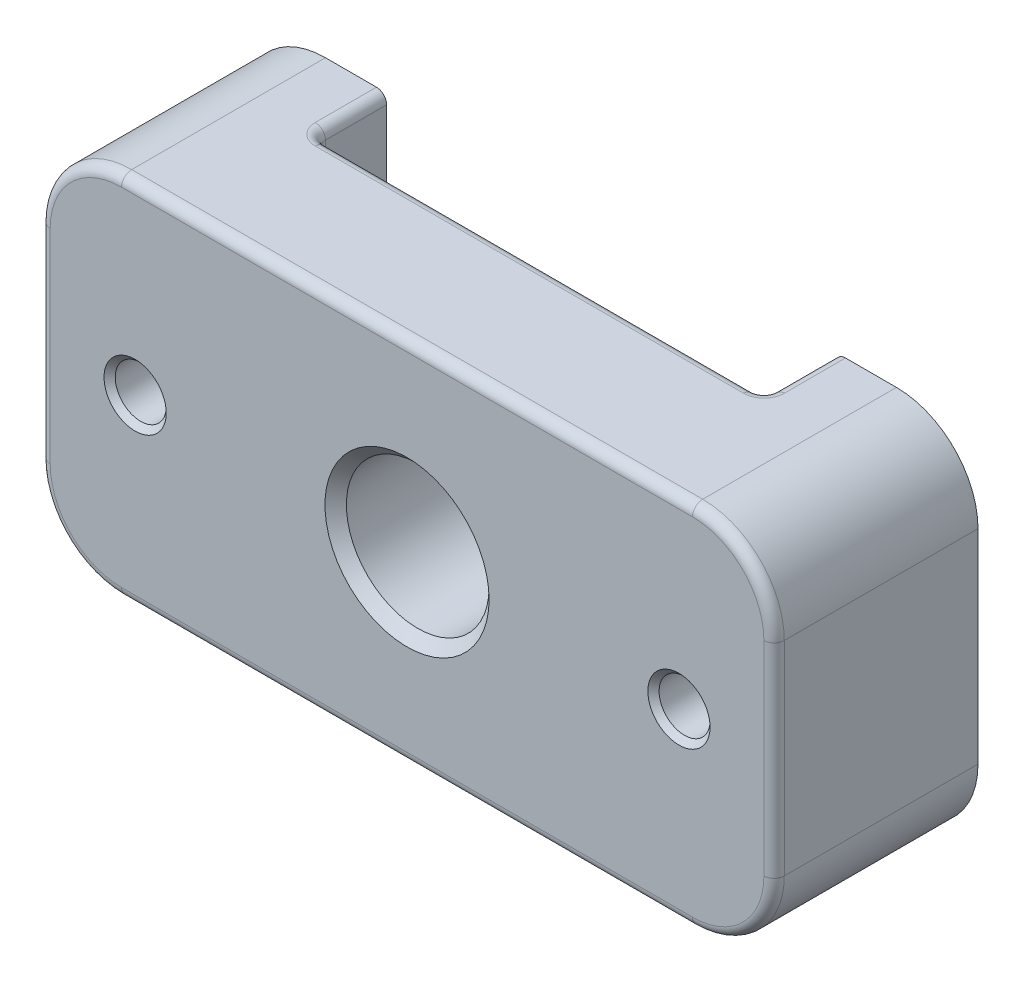
from build123d import *

# Parameters (mm, degrees)
BOSS_EXTRUDE1_DEPTH             = 10
SKETCH5_W                       = 22
SKETCH5_H                       = 7
CUT_EXTRUDE2_DEPTH              = 28.349588662
FILLET3_R                       = 0.5
M3X0_5_TAPPED_HOLE1_D           = 2.5
M3X0_5_TAPPED_HOLE1_CSINK_D     = 3.05
M3X0_5_TAPPED_HOLE1_CSINK_ANGLE = 90
M8X1_0_TAPPED_HOLE1_D           = 7
M8X1_0_TAPPED_HOLE1_CSINK_D     = 8.05
M8X1_0_TAPPED_HOLE1_CSINK_ANGLE = 90


with BuildPart() as part:
    # Sketch1 → Boss-Extrude1 (new body)
    with BuildSketch(Plane.XY):
        with BuildLine():
            Line((-14, 9.141740125), (14, 9.141740125))
            ThreePointArc((14, 9.141740125), (16.828427125, 7.97016725), (18, 5.141740125))
            Line((18, 5.141740125), (18, -4.858259875))
            ThreePointArc((18, -4.858259875), (16.828427125, -7.686686999), (14, -8.858259875))
            Line((14, -8.858259875), (-14, -8.858259875))
            ThreePointArc((-14, -8.858259875), (-16.828427125, -7.686686999), (-18, -4.858259875))
            Line((-18, -4.858259875), (-18, 5.141740125))
            ThreePointArc((-18, 5.141740125), (-16.828427125, 7.97016725), (-14, 9.141740125))
        make_face()
    extrude(amount=BOSS_EXTRUDE1_DEPTH)

    # Sketch5 → Cut-Extrude2 (cut, through all)
    with BuildSketch(Plane(origin=(0, 9.141740125, 0), x_dir=(1, 0, 0), z_dir=(0, 1, 0))):
        Rectangle(SKETCH5_W, SKETCH5_H)
    extrude(amount=-CUT_EXTRUDE2_DEPTH, mode=Mode.SUBTRACT)

    # Fillet3
    fillet3_edges = [part.edges().sort_by_distance(p)[0] for p in [
        (-16.828427125, 7.97016725, 10),
        (-18, 0.141740125, 10),
        (-16.828427125, -7.686686999, 10),
        (0, -8.858259875, 10),
        (16.828427125, -7.686686999, 10),
        (11, -8.858259875, 1.75),
        (18, 0.141740125, 10),
        (0, -8.858259875, 3.5),
        (11, 0.141740125, 3.5),
        (-11, -8.858259875, 1.75),
        (-11, 0.141740125, 3.5),
        (-11, 9.141740125, 1.75),
        (0, 9.141740125, 3.5),
        (11, 9.141740125, 1.75),
        (16.828427125, 7.97016725, 10),
        (0, 9.141740125, 10),
    ]]
    fillet(fillet3_edges, radius=FILLET3_R)

    # M3x0.5 Tapped Hole1 (through all)
    with Locations(Plane(origin=(-13.335, 0.141740125, 10), x_dir=(1, 0, 0), z_dir=(0, 0, 1))):
        with Locations((0, 0), (26.67, 0)):
            CounterSinkHole(M3X0_5_TAPPED_HOLE1_D / 2, M3X0_5_TAPPED_HOLE1_CSINK_D / 2, counter_sink_angle=M3X0_5_TAPPED_HOLE1_CSINK_ANGLE)

    # M8x1.0 Tapped Hole1 (through all)
    with Locations(Plane(origin=(0, 0.141740125, 10), x_dir=(1, 0, 0), z_dir=(0, 0, 1))):
        with Locations((0, 0)):
            CounterSinkHole(M8X1_0_TAPPED_HOLE1_D / 2, M8X1_0_TAPPED_HOLE1_CSINK_D / 2, counter_sink_angle=M8X1_0_TAPPED_HOLE1_CSINK_ANGLE)


solid = part.part
